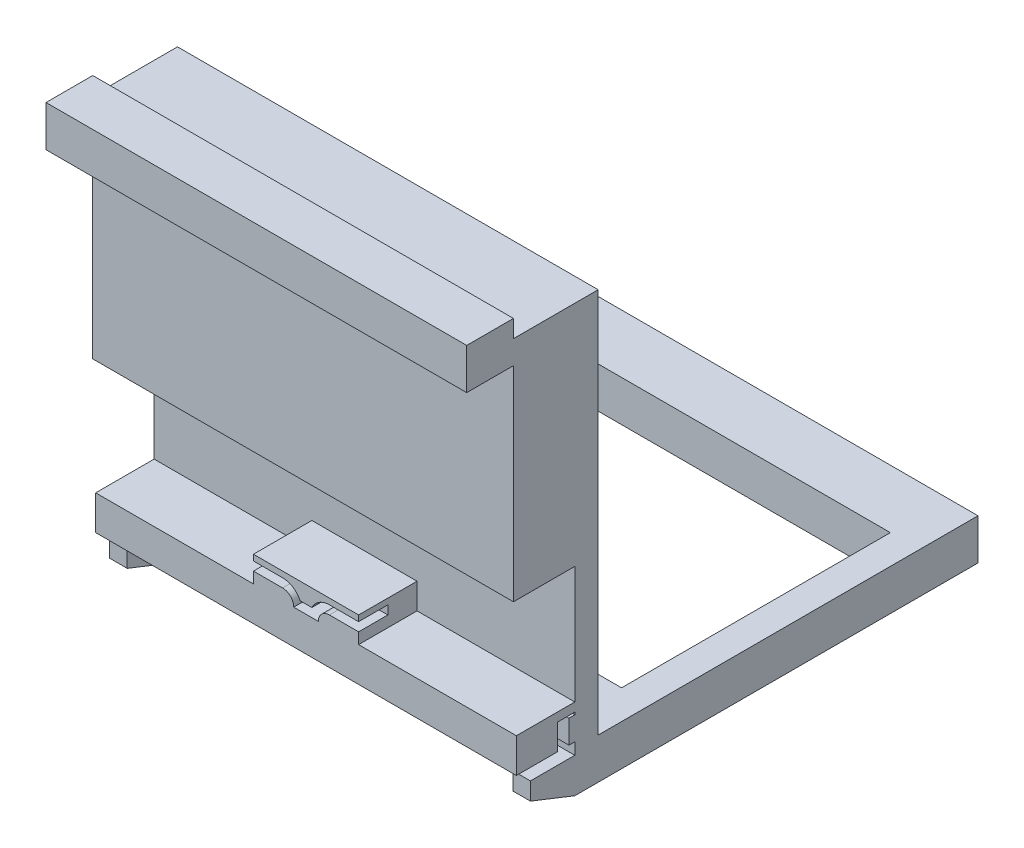
from build123d import *

# Parameters (mm, degrees)
CROQUIS1_W               = 72
CROQUIS1_H               = 74
SALIENTE_EXTRUIR3_DEPTH  = 4
CROQUIS2_W               = 3
CROQUIS2_H               = 6
SALIENTE_EXTRUIR4_DEPTH  = 7.6
CORTAR_EXTRUIR3_DEPTH    = 83.938591741
CROQUIS5_W               = 5
CROQUIS5_H               = 4
SALIENTE_EXTRUIR5_DEPTH  = 1
CROQUIS9_W               = 72
CROQUIS9_H               = 1.5
SALIENTE_EXTRUIR6_DEPTH  = 8
CROQUIS10_W              = 72
CROQUIS10_H              = 5.9
SALIENTE_EXTRUIR7_DEPTH  = 2
CROQUIS11_W              = 10
CROQUIS11_H              = 4.4
SALIENTE_EXTRUIR10_DEPTH = 7
SALIENTE_EXTRUIR14_DEPTH = 10
CROQUIS15_W              = 18
CROQUIS15_H              = 4.4
SALIENTE_EXTRUIR15_DEPTH = 5
CROQUIS16_W              = 72
CROQUIS16_H              = 40
SALIENTE_EXTRUIR16_DEPTH = 10.5
CROQUIS17_W              = 72
CROQUIS17_H              = 5
SALIENTE_EXTRUIR17_DEPTH = 8
CROQUIS18_W              = 72
CROQUIS18_H              = 8
SALIENTE_EXTRUIR19_DEPTH = 2
CROQUIS19_W              = 72
CROQUIS19_H              = 1
CORTAR_EXTRUIR4_DEPTH    = 14.5
CROQUIS20_W              = 72
CROQUIS20_H              = 7
SALIENTE_EXTRUIR20_DEPTH = 65
CROQUIS21_W              = 57
CROQUIS21_H              = 46
CORTAR_EXTRUIR5_DEPTH    = 65


with BuildPart() as part:
    # Croquis1 → Saliente-Extruir3 (new body)
    with BuildSketch(Plane.XY):
        with Locations((0, -2.5)):
            Rectangle(CROQUIS1_W, CROQUIS1_H)
    extrude(amount=SALIENTE_EXTRUIR3_DEPTH)

    # Croquis2 → Saliente-Extruir4 (add)
    with BuildSketch(Plane.XY.offset(4)):
        with Locations((-34.5, -36.5)):
            Rectangle(CROQUIS2_W, CROQUIS2_H)
        with Locations((34.5, -36.5)):
            Rectangle(CROQUIS2_W, CROQUIS2_H)
    extrude(amount=SALIENTE_EXTRUIR4_DEPTH)

    # Croquis3 → Cortar-Extruir3 (cut, through all)
    with BuildSketch(Plane.ZY.offset(36)):
        Polygon((4, -39.5), (11.6, -36.5), (11.6, -39.5), align=None)
    extrude(amount=-CORTAR_EXTRUIR3_DEPTH, mode=Mode.SUBTRACT)

    # Croquis5 → Saliente-Extruir5 (add)
    with BuildSketch(Plane.XY.offset(4)):
        with Locations((-33.5, -30.5)):
            Rectangle(CROQUIS5_W, CROQUIS5_H)
        with Locations((33.5, -29.5)):
            Rectangle(CROQUIS5_W, CROQUIS5_H)
    extrude(amount=SALIENTE_EXTRUIR5_DEPTH)

    # Croquis9 → Saliente-Extruir6 (add)
    with BuildSketch(Plane.XY.offset(4)):
        with Locations((0, -26.35)):
            Rectangle(CROQUIS9_W, CROQUIS9_H)
    extrude(amount=SALIENTE_EXTRUIR6_DEPTH)

    # Croquis10 → Saliente-Extruir7 (add)
    with BuildSketch(Plane.XY.offset(12)):
        with Locations((0, -28.55)):
            Rectangle(CROQUIS10_W, CROQUIS10_H)
    extrude(amount=SALIENTE_EXTRUIR7_DEPTH)

    # Croquis11 → Saliente-Extruir10 (add)
    with BuildSketch(Plane.XY.offset(14)):
        with Locations((-31, -29.3)):
            Rectangle(CROQUIS11_W, CROQUIS11_H)
        with Locations((31, -29.3)):
            Rectangle(CROQUIS11_W, CROQUIS11_H)
    extrude(amount=-SALIENTE_EXTRUIR10_DEPTH)

    # Croquis14 → Saliente-Extruir14 (add)
    with BuildSketch(Plane.XY.offset(4)):
        with BuildLine():
            Line((-9, -23.7), (-9, -25.6))
            Line((-9, -25.6), (-2.1, -25.6))
            ThreePointArc((-2.1, -25.6), (-2.656497116, -24.256497116), (-4, -23.7))
            Line((-4, -23.7), (-9, -23.7))
        make_face()
        with BuildLine():
            Line((-9, -21.2), (-9, -22.2))
            Line((-9, -22.2), (-4, -22.2))
            ThreePointArc((-4, -22.2), (-2.22447191, -22.714955647), (-1, -24.1))
            Line((-1, -24.1), (1, -24.1))
            ThreePointArc((1, -24.1), (2.22447191, -22.714955647), (4, -22.2))
            Line((4, -22.2), (9, -22.2))
            Line((9, -22.2), (9, -21.2))
            Line((9, -21.2), (-9, -21.2))
        make_face()
        with BuildLine():
            ThreePointArc((4, -23.7), (2.656497116, -24.256497116), (2.1, -25.6))
            Line((2.1, -25.6), (9, -25.6))
            Line((9, -25.6), (9, -23.7))
            Line((9, -23.7), (4, -23.7))
        make_face()
    extrude(amount=SALIENTE_EXTRUIR14_DEPTH)

    # Croquis15 → Saliente-Extruir15 (add)
    with BuildSketch(Plane.XY.offset(4)):
        with Locations((0, -23.4)):
            Rectangle(CROQUIS15_W, CROQUIS15_H)
    extrude(amount=SALIENTE_EXTRUIR15_DEPTH)

    # Croquis16 → Saliente-Extruir16 (add)
    with BuildSketch(Plane.XY.offset(4)):
        with Locations((0, 14.5)):
            Rectangle(CROQUIS16_W, CROQUIS16_H)
    extrude(amount=SALIENTE_EXTRUIR16_DEPTH)

    # Croquis17 → Saliente-Extruir17 (add)
    with BuildSketch(Plane.XY.offset(14.5)):
        with Locations((0, 32)):
            Rectangle(CROQUIS17_W, CROQUIS17_H)
    extrude(amount=SALIENTE_EXTRUIR17_DEPTH)

    # Croquis18 → Saliente-Extruir19 (add)
    with BuildSketch(Plane(origin=(0, 34.5, 0), x_dir=(1, 0, 0), z_dir=(0, 1, 0))):
        with Locations((0, -18.5)):
            Rectangle(CROQUIS18_W, CROQUIS18_H)
    extrude(amount=SALIENTE_EXTRUIR19_DEPTH)

    # Croquis19 → Cortar-Extruir4 (cut)
    with BuildSketch(Plane(origin=(0, 0, 0), x_dir=(-1, 0, 0), z_dir=(0, 0, -1))):
        with Locations((0, 34)):
            Rectangle(CROQUIS19_W, CROQUIS19_H)
    extrude(amount=-CORTAR_EXTRUIR4_DEPTH, mode=Mode.SUBTRACT)

    # Croquis20 → Saliente-Extruir20 (add)
    with BuildSketch(Plane(origin=(0, 0, 0), x_dir=(-1, 0, 0), z_dir=(0, 0, -1))):
        with Locations((0, -36)):
            Rectangle(CROQUIS20_W, CROQUIS20_H)
    extrude(amount=SALIENTE_EXTRUIR20_DEPTH)

    # Croquis21 → Cortar-Extruir5 (cut)
    with BuildSketch(Plane(origin=(0, -32.5, 0), x_dir=(1, 0, 0), z_dir=(0, 1, 0))):
        with Locations((2.5, 32)):
            Rectangle(CROQUIS21_W, CROQUIS21_H)
    extrude(amount=-CORTAR_EXTRUIR5_DEPTH, mode=Mode.SUBTRACT)


solid = part.part
